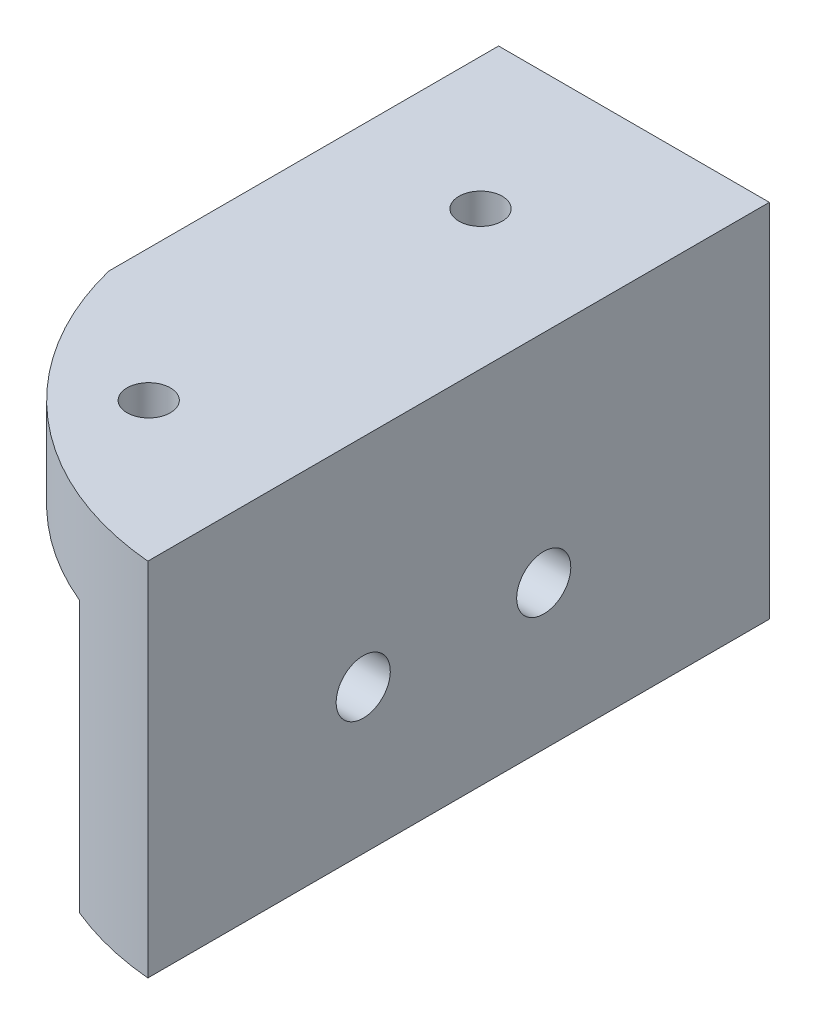
from build123d import *

# Parameters (mm, degrees)
BOSS_EXTRUDE1_DEPTH = 35
CUT_EXTRUDE1_REACH  = 42.927
SKETCH3_R           = 1.2
CUT_EXTRUDE2_REACH  = 43.533
SKETCH4_R           = 1.5
CUT_EXTRUDE4_REACH  = 45.012
CUT_EXTRUDE3_REACH  = 44.552
SKETCH5_W           = 15
SKETCH5_H           = 35


with BuildPart() as part:
    # Sketch1 → Boss-Extrude1 (new body)
    with BuildSketch(Plane.XY):
        Polygon((0, 0), (0, 20), (15, 20), (15, 15), (5, 15), (5, 0), align=None)
    boss_extrude1 = extrude(amount=BOSS_EXTRUDE1_DEPTH)

    # Sketch3 → Cut-Extrude1 (cut, up to next)
    with BuildSketch(Plane.XZ.offset(-15), mode=Mode.PRIVATE) as cut_extrude1_sk1:
        with Locations((7.692388155, 26.692388155)):
            Circle(SKETCH3_R)
    cut_extrude1_tool1 = extrude(cut_extrude1_sk1.sketch, amount=-CUT_EXTRUDE1_REACH, mode=Mode.PRIVATE) & part.part
    # Sketch3 → Cut-Extrude1 (cut, up to next)
    with BuildSketch(Plane.XZ.offset(-15), mode=Mode.PRIVATE) as cut_extrude1_sk2:
        with Locations((7.692388155, 8.307611845)):
            Circle(SKETCH3_R)
    cut_extrude1_tool2 = extrude(cut_extrude1_sk2.sketch, amount=-CUT_EXTRUDE1_REACH, mode=Mode.PRIVATE) & part.part
    cut_extrude1_1 = cut_extrude1_tool1.solids().sort_by_distance((7.692388, 15, 26.692388))[0]
    add(cut_extrude1_1, mode=Mode.SUBTRACT)
    cut_extrude1_2 = cut_extrude1_tool2.solids().sort_by_distance((7.692388, 15, 8.307612))[0]
    add(cut_extrude1_2, mode=Mode.SUBTRACT)
    cut_extrude1 = cut_extrude1_1 + cut_extrude1_2  # Cut-Extrude1 as one shape, for the pattern or mirror that repeats it

    # Sketch4 → Cut-Extrude2 (cut, up to next)
    with BuildSketch(Plane(origin=(5, 0, 0), x_dir=(0, 0, -1), z_dir=(1, 0, 0)), mode=Mode.PRIVATE) as cut_extrude2_sk1:
        with Locations(Location((-22.5, 8, 0), (0, 0, 90))):
            Circle(SKETCH4_R)
    cut_extrude2_tool1 = extrude(cut_extrude2_sk1.sketch, amount=-CUT_EXTRUDE2_REACH, mode=Mode.PRIVATE) & part.part
    # Sketch4 → Cut-Extrude2 (cut, up to next)
    with BuildSketch(Plane(origin=(5, 0, 0), x_dir=(0, 0, -1), z_dir=(1, 0, 0)), mode=Mode.PRIVATE) as cut_extrude2_sk2:
        with Locations(Location((-12.5, 8, 0), (0, 0, 90))):
            Circle(SKETCH4_R)
    cut_extrude2_tool2 = extrude(cut_extrude2_sk2.sketch, amount=-CUT_EXTRUDE2_REACH, mode=Mode.PRIVATE) & part.part
    cut_extrude2_1 = cut_extrude2_tool1.solids().sort_by_distance((5, 8, 22.5))[0]
    add(cut_extrude2_1, mode=Mode.SUBTRACT)
    cut_extrude2_2 = cut_extrude2_tool2.solids().sort_by_distance((5, 8, 12.5))[0]
    add(cut_extrude2_2, mode=Mode.SUBTRACT)
    cut_extrude2 = cut_extrude2_1 + cut_extrude2_2  # Cut-Extrude2 as one shape, for the pattern or mirror that repeats it

    # Sketch6 → Cut-Extrude4 (cut, up to next)
    with BuildSketch(Plane(origin=(0, 20, 0), x_dir=(1, 0, 0), z_dir=(0, 1, 0)), mode=Mode.PRIVATE) as cut_extrude4_sk1:
        with BuildLine():
            Line((-1.5, -34.5), (-1.5, -42.5))
            ThreePointArc((-1.5, -42.5), (16.17766953, -35.17766953), (23.5, -17.5))
            Line((23.5, -17.5), (15.5, -17.5))
            ThreePointArc((15.5, -17.5), (10.52081528, -29.52081528), (-1.5, -34.5))
        make_face()
    cut_extrude4_tool1 = extrude(cut_extrude4_sk1.sketch, amount=-CUT_EXTRUDE4_REACH, mode=Mode.PRIVATE) & part.part
    cut_extrude4 = cut_extrude4_tool1.solids().sort_by_distance((12.030696, 20, 31.030696))[0]
    add(cut_extrude4, mode=Mode.SUBTRACT)

    # Mirror1: Boss-Extrude1, Cut-Extrude1, Cut-Extrude2, Cut-Extrude4 across plane
    add(boss_extrude1.mirror(Plane(origin=(0, 0, 35), x_dir=(0, 0, 1), z_dir=(1, 0, 0))))
    add(cut_extrude1.mirror(Plane(origin=(0, 0, 35), x_dir=(0, 0, 1), z_dir=(1, 0, 0))), mode=Mode.SUBTRACT)
    add(cut_extrude2.mirror(Plane(origin=(0, 0, 35), x_dir=(0, 0, 1), z_dir=(1, 0, 0))), mode=Mode.SUBTRACT)
    add(cut_extrude4.mirror(Plane(origin=(0, 0, 35), x_dir=(0, 0, 1), z_dir=(1, 0, 0))), mode=Mode.SUBTRACT)

    # Sketch5 → Cut-Extrude3 (cut, up to next)
    with BuildSketch(Plane(origin=(0, 20, 0), x_dir=(1, 0, 0), z_dir=(0, 1, 0)), mode=Mode.PRIVATE) as cut_extrude3_sk1:
        with Locations((7.5, -17.5)):
            Rectangle(SKETCH5_W, SKETCH5_H)
    cut_extrude3_tool1 = extrude(cut_extrude3_sk1.sketch, amount=-CUT_EXTRUDE3_REACH, mode=Mode.PRIVATE) & part.part
    add(cut_extrude3_tool1.solids().sort_by_distance((7.5, 20, 17.5))[0], mode=Mode.SUBTRACT)


solid = part.part
